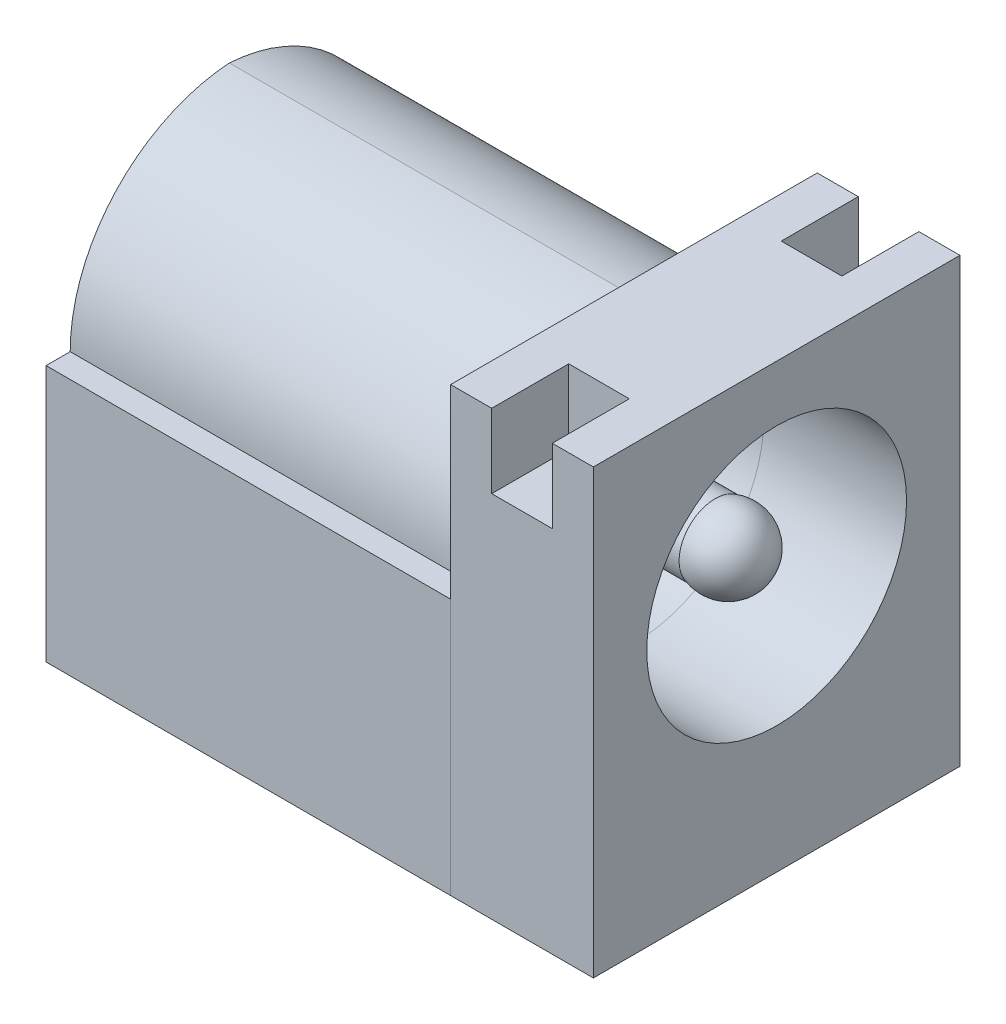
from build123d import *

# Parameters (mm, degrees)
SKETCH1_W         = 9.0678
SKETCH1_H         = 10.9474
EXTRUDE1_DEPTH    = 3.5306
EXTRUDE2_DEPTH    = 10.0076
SKETCH3_R         = 3.2131
EXTRUDE3_DEPTH    = 9.0678
SKETCH4_R         = 0.889
EXTRUDE4_DEPTH    = 7.5438
DOME1_FACE_RADIUS = 0.889
DOME1_HEIGHT      = 1.27
SKETCH5_W         = 1.4986
SKETCH5_H         = 3.175
EXTRUDE5_DEPTH    = 1.8288


with BuildPart() as part:
    # Sketch1 → Extrude1 (new body)
    with BuildSketch(Plane(origin=(0, 0, 0), x_dir=(0, 0, -1), z_dir=(1, 0, 0))):
        Rectangle(SKETCH1_W, SKETCH1_H)
    extrude(amount=-EXTRUDE1_DEPTH)


with BuildPart() as body_2:
    # Sketch2 → Extrude2 (new body)
    with BuildSketch(Plane.ZY.offset(3.5306)):
        with BuildLine():
            Line((-4.5339, -5.4737), (4.5339, -5.4737))
            Line((4.5339, -5.4737), (4.5339, 0.8763))
            Line((4.5339, 0.8763), (3.937, 0.8763))
            ThreePointArc((3.937, 0.8763), (2.799736174, 3.760654259), (0, 5.0927))
            ThreePointArc((0, 5.0927), (-2.799736174, 3.760654259), (-3.937, 0.8763))
            Line((-3.937, 0.8763), (-4.5339, 0.8763))
            Line((-4.5339, 0.8763), (-4.5339, -5.4737))
        make_face()
    extrude(amount=EXTRUDE2_DEPTH)


with BuildPart() as extrude3_tool:
    # Sketch3 → Extrude3 (new body)
    with BuildSketch(Plane(origin=(0, 0, 0), x_dir=(0, 0, -1), z_dir=(1, 0, 0))):
        with Locations((0, 0.8763)):
            Circle(SKETCH3_R)
    extrude(amount=-EXTRUDE3_DEPTH)


with BuildPart() as part_1:
    add(part.part)

    # Extrude3: cut by extrude3_tool
    add(extrude3_tool.part, mode=Mode.SUBTRACT)

    # Sketch5 → Extrude5 (cut)
    with BuildSketch(Plane(origin=(0, 5.4737, 0), x_dir=(1, 0, 0), z_dir=(0, 1, 0))):
        with Locations((-1.7653, -4.2164)):
            Rectangle(SKETCH5_W, SKETCH5_H)
        with Locations((-1.7653, 4.2164)):
            Rectangle(SKETCH5_W, SKETCH5_H)
    extrude(amount=-EXTRUDE5_DEPTH, mode=Mode.SUBTRACT)


with BuildPart() as body_2_1:
    add(body_2.part)

    # Extrude3: cut by extrude3_tool
    add(extrude3_tool.part, mode=Mode.SUBTRACT)


with BuildPart() as body_3:
    # Sketch4 → Extrude4 (new body)
    with BuildSketch(Plane(origin=(-9.0678, 0, 0), x_dir=(0, 0, -1), z_dir=(1, 0, 0))):
        with Locations((0, 0.8763)):
            Circle(SKETCH4_R)
    extrude(amount=EXTRUDE4_DEPTH)

    # Dome1: a dome of height H over a round flat face of radius A is a cap of a sphere of radius (A * A + H * H) / (2 * H)
    dome1_r = (DOME1_FACE_RADIUS * DOME1_FACE_RADIUS + DOME1_HEIGHT * DOME1_HEIGHT) / (2 * DOME1_HEIGHT)
    dome1_base = Plane((-1.524, 0.8763, 0), z_dir=(1, 0, 0))
    with Locations(dome1_base.offset(DOME1_HEIGHT - dome1_r)):
        dome1_ball = Sphere(dome1_r, mode=Mode.PRIVATE)
    add(split(dome1_ball, bisect_by=dome1_base, keep=Keep.TOP, mode=Mode.PRIVATE))


solid = Compound([part_1.part, body_2_1.part, body_3.part])
